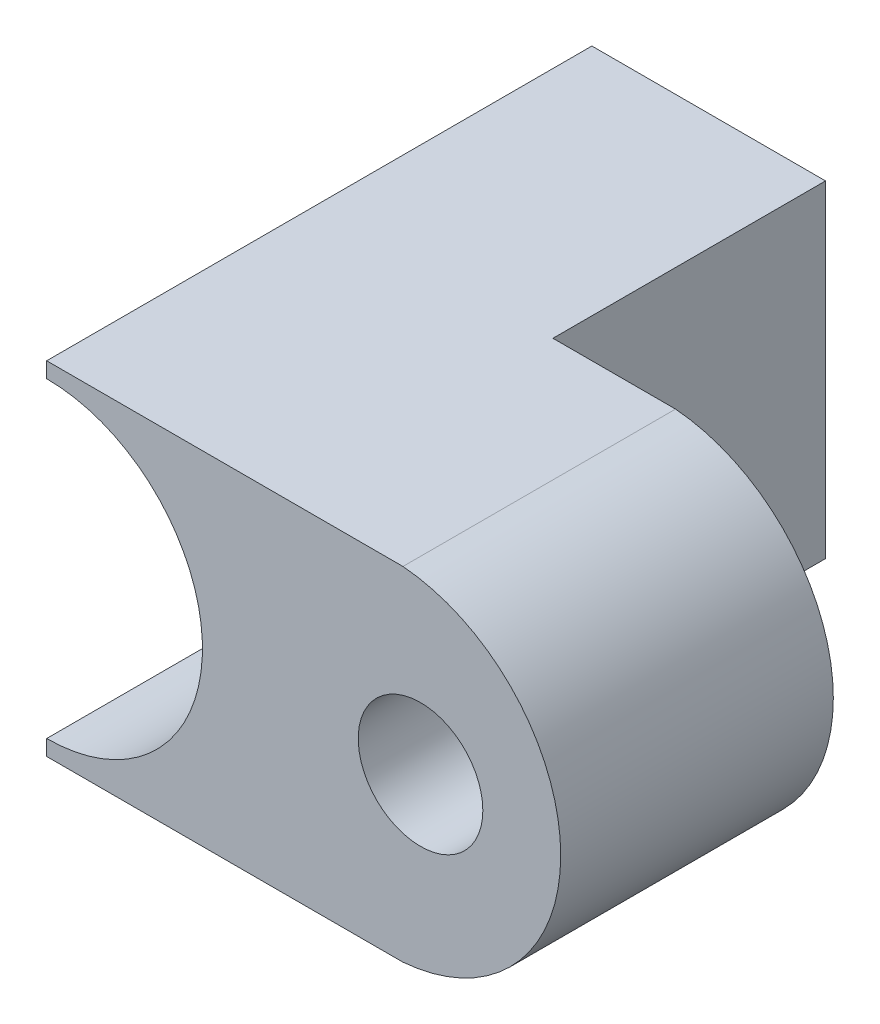
from build123d import *

# Parameters (mm, degrees)
BOSS_EXTRUDE1_DEPTH          = 44.45
CUT_EXTRUDE1_DEPTH           = 22.225
F_3_8_0_375_DIAMETER_HOLE1_D = 10.16
CHAMFER1_SIZE                = 1.27


with BuildPart() as part:
    # Sketch1 → Boss-Extrude1 (new body)
    with BuildSketch(Plane.XY):
        with BuildLine():
            Line((0, -1.27), (29.046742048, -1.27))
            ThreePointArc((29.046742048, -1.27), (41.91, 12.7), (29.046742048, 26.67))
            Line((29.046742048, 26.67), (0, 26.67))
            Line((0, 26.67), (0, 25.4))
            ThreePointArc((0, 25.4), (12.7, 12.7), (0, 0))
            Line((0, 0), (0, -1.27))
        make_face()
    extrude(amount=BOSS_EXTRUDE1_DEPTH)

    # Sketch2 → Cut-Extrude1 (cut)
    with BuildSketch(Plane(origin=(0, 0, 0), x_dir=(-1, 0, 0), z_dir=(0, 0, -1))):
        with BuildLine():
            Line((-19.05, -1.27), (-19.05, 26.67))
            Line((-19.05, 26.67), (-29.046742048, 26.67))
            ThreePointArc((-29.046742048, 26.67), (-41.91, 12.7), (-29.046742048, -1.27))
            Line((-29.046742048, -1.27), (-19.05, -1.27))
        make_face()
    extrude(amount=-CUT_EXTRUDE1_DEPTH, mode=Mode.SUBTRACT)

    # 3/8 (0.375) Diameter Hole1 (through all)
    with Locations(Plane.XY.offset(44.45)):
        with Locations((30.48, 12.7)):
            Hole(F_3_8_0_375_DIAMETER_HOLE1_D / 2)

    # Chamfer1
    chamfer1_edges = [part.edges().sort_by_distance(p)[0] for p in [
        (19.05, -1.27, 11.1125),
    ]]
    chamfer(chamfer1_edges, length=CHAMFER1_SIZE)


solid = part.part
